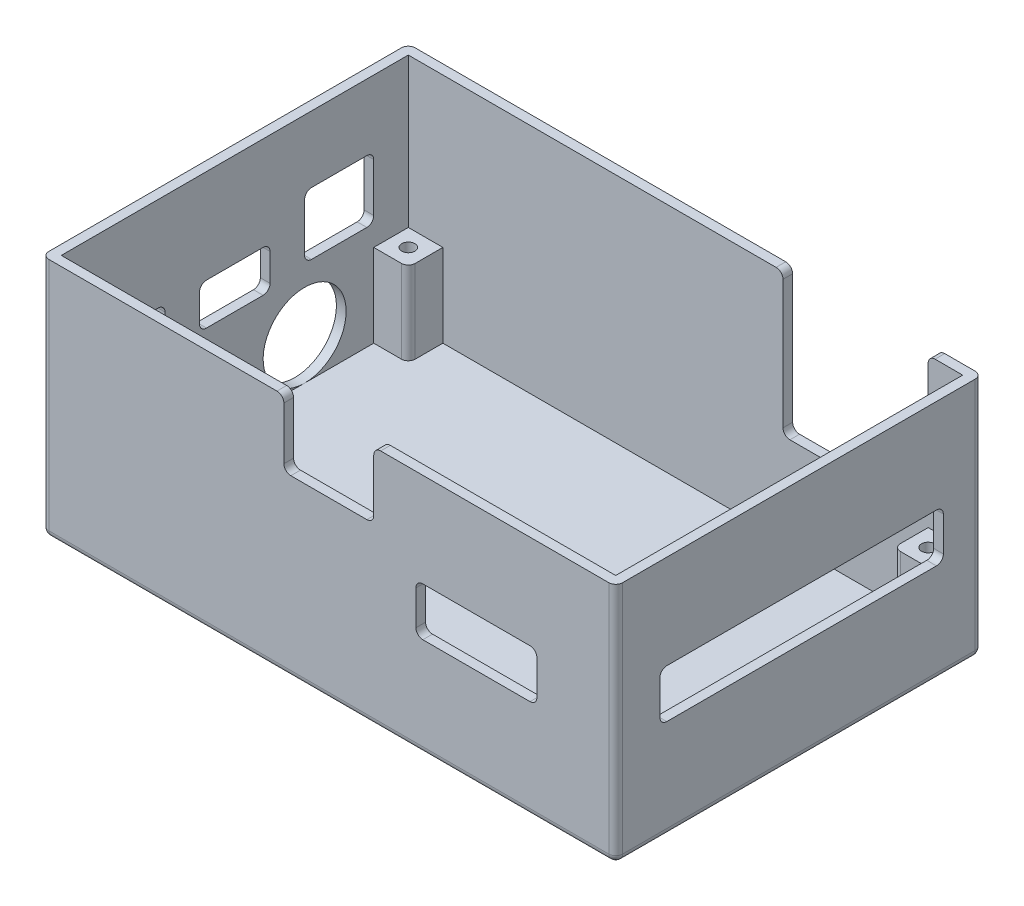
from build123d import *

# Parameters (mm, degrees)
SKETCH_1_W          = 83
SKETCH_1_H          = 53
SKETCH_1_W_2        = 80.2
SKETCH_1_H_2        = 50.2
EXTRUDE_1_DEPTH     = 35
SKETCH_3_W          = 80.2
SKETCH_3_H          = 50.2
EXTRUDE_2_DEPTH     = 1.4
SKETCH_4_W          = 5
SKETCH_4_H          = 5
SKETCH_4_R          = 0.95
EXTRUDE_3_DEPTH     = 12
SKETCH_5_W          = 41
SKETCH_5_H          = 7
CUT_EXTRUDE_1_DEPTH = 10
SKETCH_6_W          = 10
SKETCH_6_H          = 7
SKETCH_6_H_2        = 9
SKETCH_6_W_2        = 10.2
SKETCH_6_H_3        = 6
CUT_EXTRUDE_2_DEPTH = 10
SKETCH_8_W          = 21
SKETCH_8_H          = 21
CUT_EXTRUDE_4_DEPTH = 10
SKETCH_9_W          = 13
SKETCH_9_H          = 9.6
CUT_EXTRUDE_5_DEPTH = 10
FILLET_1_R          = 1
FILLET_2_R          = 1
SKETCH_11_W         = 17.500857193
SKETCH_11_H         = 7
CUT_EXTRUDE_7_DEPTH = 10
FILLET_5_R          = 1
SKETCH_13_R         = 6
CUT_EXTRUDE_8_DEPTH = 10
FILLET_6_R          = 1
FILLET_7_R          = 1


with BuildPart() as part:
    # 草图1 → 凸台-拉伸1 (new body)
    with BuildSketch(Plane(origin=(0, 0, 0), x_dir=(1, 0, 0), z_dir=(0, 1, 0))):
        with Locations((40.1, 25.1)):
            Rectangle(SKETCH_1_W, SKETCH_1_H)
        with Locations((40.1, 25.1)):
            Rectangle(SKETCH_1_W_2, SKETCH_1_H_2, mode=Mode.SUBTRACT)
    extrude(amount=EXTRUDE_1_DEPTH)

    # 草图3 → 凸台-拉伸2 (add)
    with BuildSketch(Plane(origin=(0, 0, 0), x_dir=(1, 0, 0), z_dir=(0, 1, 0))):
        with Locations((40.1, 25.1)):
            Rectangle(SKETCH_3_W, SKETCH_3_H)
    extrude(amount=EXTRUDE_2_DEPTH)

    # 草图4 → 凸台-拉伸3 (add)
    # profile 1 of 4: a face of its own
    with BuildSketch(Plane(origin=(0, 1.4, 0), x_dir=(1, 0, 0), z_dir=(0, 1, 0))):
        with Locations((2.5, 47.7)):
            Rectangle(SKETCH_4_W, SKETCH_4_H)
        with Locations(Location((2.5, 47.7, 0), (0, 0, 270))):
            Circle(SKETCH_4_R, mode=Mode.SUBTRACT)
    # profile 2 of 4: a face of its own
    with BuildSketch(Plane(origin=(0, 1.4, 0), x_dir=(1, 0, 0), z_dir=(0, 1, 0))):
        with Locations((2.5, 2.5)):
            Rectangle(SKETCH_4_W, SKETCH_4_H)
        with Locations(Location((2.5, 2.5, 0), (0, 0, 270))):
            Circle(SKETCH_4_R, mode=Mode.SUBTRACT)
    # profile 3 of 4: a face of its own
    with BuildSketch(Plane(origin=(0, 1.4, 0), x_dir=(1, 0, 0), z_dir=(0, 1, 0))):
        with Locations((77.7, 47.7)):
            Rectangle(SKETCH_4_W, SKETCH_4_H)
        with Locations(Location((77.7, 47.7, 0), (0, 0, 270))):
            Circle(SKETCH_4_R, mode=Mode.SUBTRACT)
    # profile 4 of 4: a face of its own
    with BuildSketch(Plane(origin=(0, 1.4, 0), x_dir=(1, 0, 0), z_dir=(0, 1, 0))):
        with Locations((77.7, 2.5)):
            Rectangle(SKETCH_4_W, SKETCH_4_H)
        with Locations(Location((77.7, 2.184711345, 0), (0, 0, 270))):
            Circle(SKETCH_4_R, mode=Mode.SUBTRACT)
    extrude(amount=EXTRUDE_3_DEPTH)

    # 草图5 → 切除-拉伸1 (cut)
    with BuildSketch(Plane.ZY.offset(-80.2)):
        with Locations((-25.5, 17.9)):
            Rectangle(SKETCH_5_W, SKETCH_5_H)
    extrude(amount=-CUT_EXTRUDE_1_DEPTH, mode=Mode.SUBTRACT)

    # 草图6 → 切除-拉伸2 (cut)
    with BuildSketch(Plane(origin=(0, 0, 0), x_dir=(0, 0, -1), z_dir=(1, 0, 0))):
        with Locations((10, 17.9)):
            Rectangle(SKETCH_6_W, SKETCH_6_H)
        with Locations((40.2, 20.9)):
            Rectangle(SKETCH_6_W, SKETCH_6_H_2)
        with Locations((25.1, 18.4)):
            Rectangle(SKETCH_6_W_2, SKETCH_6_H_3)
    extrude(amount=-CUT_EXTRUDE_2_DEPTH, mode=Mode.SUBTRACT)

    # 草图8 → 切除-拉伸4 (cut)
    with BuildSketch(Plane.XY.offset(-50.2)):
        with Locations((64.7, 24.9)):
            Rectangle(SKETCH_8_W, SKETCH_8_H)
    extrude(amount=-CUT_EXTRUDE_4_DEPTH, mode=Mode.SUBTRACT)

    # 草图9 → 切除-拉伸5 (cut)
    with BuildSketch(Plane(origin=(0, 0, 0), x_dir=(-1, 0, 0), z_dir=(0, 0, -1))):
        with Locations((-40.1, 30.2)):
            Rectangle(SKETCH_9_W, SKETCH_9_H)
    extrude(amount=-CUT_EXTRUDE_5_DEPTH, mode=Mode.SUBTRACT)

    # 圆角1
    fillet_1_edges = [part.edges().sort_by_distance(p)[0] for p in [
        (80.9, 21.4, -5),
        (80.9, 14.4, -5),
        (80.9, 14.4, -46),
        (80.9, 21.4, -46),
        (-0.7, 14.4, -5),
        (-0.7, 21.4, -5),
        (-0.7, 21.4, -15),
        (-0.7, 14.4, -15),
        (-0.7, 25.4, -45.2),
        (-0.7, 16.4, -45.2),
        (-0.7, 16.4, -35.2),
        (-0.7, 25.4, -35.2),
        (-0.7, 15.4, -20),
        (-0.7, 21.4, -20),
        (-0.7, 15.4, -30.2),
        (75.2, 14.4, -50.9),
        (54.2, 14.4, -50.9),
        (46.6, 25.4, 0.7),
        (33.6, 25.4, 0.7),
        (5, 7.4, -5),
        (5, 7.4, -45.2),
        (75.2, 7.4, -45.2),
        (75.2, 7.4, -5),
    ]]
    fillet(fillet_1_edges, radius=FILLET_1_R)

    # 圆角2
    fillet_2_edges = [part.edges().sort_by_distance(p)[0] for p in [
        (40.1, 0, -51.6),
        (81.6, 0, -25.1),
        (40.1, 0, 1.4),
        (-1.4, 0, -25.1),
        (-1.4, 17.5, -51.6),
        (81.6, 17.5, -51.6),
        (81.6, 17.5, 1.4),
        (-1.4, 17.5, 1.4),
    ]]
    fillet(fillet_2_edges, radius=FILLET_2_R)

    # 草图11 → 切除-拉伸7 (cut)
    with BuildSketch(Plane(origin=(0, 0, 0), x_dir=(-1, 0, 0), z_dir=(0, 0, -1))):
        with Locations((-61.449571404, 17.9)):
            Rectangle(SKETCH_11_W, SKETCH_11_H)
    extrude(amount=-CUT_EXTRUDE_7_DEPTH, mode=Mode.SUBTRACT)

    # 圆角5
    fillet_5_edges = [part.edges().sort_by_distance(p)[0] for p in [
        (70.2, 14.4, 0.7),
        (70.2, 21.4, 0.7),
        (52.699142807, 21.4, 0.7),
        (52.699142807, 14.4, 0.7),
    ]]
    fillet(fillet_5_edges, radius=FILLET_5_R)

    # 草图13 → 切除-拉伸8 (cut)
    with BuildSketch(Plane(origin=(0, 0, 0), x_dir=(0, 0, -1), z_dir=(1, 0, 0))):
        with Locations((35.2, 7.4)):
            Circle(SKETCH_13_R)
    extrude(amount=-CUT_EXTRUDE_8_DEPTH, mode=Mode.SUBTRACT)

    # 圆角6
    fillet_6_edges = [part.edges().sort_by_distance(p)[0] for p in [
        (-0.7, 21.4, -30.2),
    ]]
    fillet(fillet_6_edges, radius=FILLET_6_R)

    # 圆角7
    fillet_7_edges = [part.edges().sort_by_distance(p)[0] for p in [
        (75.2, 35, -50.9),
        (54.2, 35, -50.9),
        (46.6, 35, 0.7),
        (33.6, 35, 0.7),
    ]]
    fillet(fillet_7_edges, radius=FILLET_7_R)


solid = part.part
